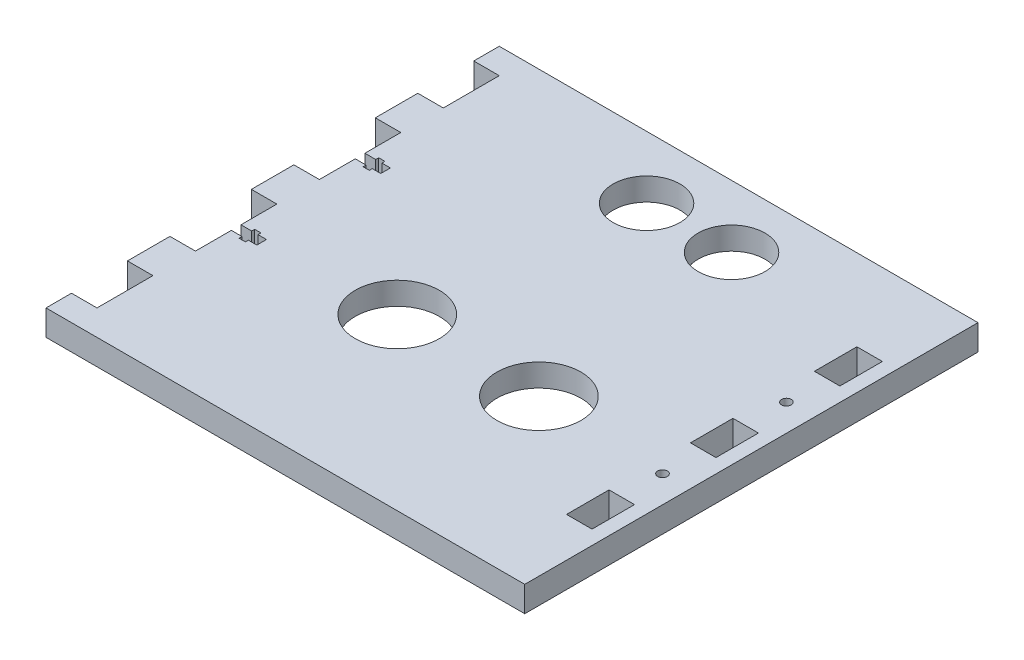
from build123d import *

# Parameters (mm, degrees)
SKETCH1_W           = 160
SKETCH1_H           = 160
BOSS_EXTRUDE1_DEPTH = 9
SKETCH2_W           = 9
SKETCH2_H           = 15
SKETCH2_H_2         = 9
BOSS_EXTRUDE2_DEPTH = 9
SKETCH3_R           = 1.7
SKETCH3_W           = 9
SKETCH3_H           = 15
CUT_EXTRUDE1_DEPTH  = 121.008333044
CUT_EXTRUDE2_DEPTH  = 121.008333044
SKETCH5_R           = 14.825
SKETCH5_R_2         = 11.8
CUT_EXTRUDE3_DEPTH  = 121.008333044
SKETCH6_W           = 40
SKETCH6_H           = 40
SKETCH6_W_2         = 62
SKETCH6_H_2         = 28
CUT_EXTRUDE4_DEPTH  = 1
FILLET1_R           = 8
FILLET2_R           = 4
SKETCH7_W           = 4.618848504
SKETCH7_H           = 0.949501447
SKETCH7_H_2         = 0.946928273
SKETCH7_W_2         = 2.666227781
SKETCH7_H_3         = 0.667544437
CUT_EXTRUDE5_DEPTH  = 1


with BuildPart() as part:
    # Sketch1 → Boss-Extrude1 (new body)
    with BuildSketch(Plane(origin=(0, 0, 0), x_dir=(1, 0, 0), z_dir=(0, 1, 0))):
        Rectangle(SKETCH1_W, SKETCH1_H)
    extrude(amount=BOSS_EXTRUDE1_DEPTH)

    # Sketch2 → Boss-Extrude2 (add)
    with BuildSketch(Plane(origin=(0, 9, 0), x_dir=(1, 0, 0), z_dir=(0, 1, 0))):
        with Locations((-84.5, 0)):
            Rectangle(SKETCH2_W, SKETCH2_H)
        with Locations((-84.5, 43.75)):
            Rectangle(SKETCH2_W, SKETCH2_H)
        with Locations((-84.5, -43.75)):
            Rectangle(SKETCH2_W, SKETCH2_H)
        with Locations((-84.5, 75.5)):
            Rectangle(SKETCH2_W, SKETCH2_H_2)
        with Locations((-84.5, -75.5)):
            Rectangle(SKETCH2_W, SKETCH2_H_2)
    extrude(amount=-BOSS_EXTRUDE2_DEPTH)

    # Sketch3 → Cut-Extrude1 (cut, through all)
    with BuildSketch(Plane(origin=(0, 9, 0), x_dir=(1, 0, 0), z_dir=(0, 1, 0))):
        with Locations(Location((70.5, 21.875, 0), (0, 0, 270))):
            Circle(SKETCH3_R)
        with Locations(Location((70.5, -21.875, 0), (0, 0, 270))):
            Circle(SKETCH3_R)
        with Locations((70.5, 43.75)):
            Rectangle(SKETCH3_W, SKETCH3_H)
        with Locations((70.5, 0)):
            Rectangle(SKETCH3_W, SKETCH3_H)
        with Locations((70.5, -43.75)):
            Rectangle(SKETCH3_W, SKETCH3_H)
    extrude(amount=-CUT_EXTRUDE1_DEPTH, mode=Mode.SUBTRACT)

    # Sketch4 → Cut-Extrude2 (cut, through all)
    with BuildSketch(Plane(origin=(0, 9, 0), x_dir=(1, 0, 0), z_dir=(0, 1, 0))):
        Polygon((-80, 23.575), (-76.2, 23.575), (-76.2, 24.625), (-74, 24.625), (-74, 23.575), (-71, 23.575), (-71, 20.175), (-74, 20.175), (-74, 19.125), (-76.2, 19.125), (-76.2, 20.175), (-80, 20.175), align=None)
        Polygon((-80, -23.575), (-80, -20.175), (-76.2, -20.175), (-76.2, -19.125), (-74, -19.125), (-74, -20.175), (-71, -20.175), (-71, -23.575), (-74, -23.575), (-74, -24.625), (-76.2, -24.625), (-76.2, -23.575), align=None)
    extrude(amount=-CUT_EXTRUDE2_DEPTH, mode=Mode.SUBTRACT)

    # Sketch5 → Cut-Extrude3 (cut, through all)
    with BuildSketch(Plane.XZ):
        with Locations(Location((25, 20, 0), (0, 0, 270))):
            Circle(SKETCH5_R)
        with Locations(Location((-25, 20, 0), (0, 0, 270))):
            Circle(SKETCH5_R)
        with Locations(Location((15, -58, 0), (0, 0, 270))):
            Circle(SKETCH5_R_2)
        with Locations(Location((-15, -58, 0), (0, 0, 270))):
            Circle(SKETCH5_R_2)
    extrude(amount=-CUT_EXTRUDE3_DEPTH, mode=Mode.SUBTRACT)

    # Sketch6 → Cut-Extrude4 (cut)
    with BuildSketch(Plane.XZ):
        with Locations((25, 20)):
            Rectangle(SKETCH6_W, SKETCH6_H)
        with Locations((-25, 20)):
            Rectangle(SKETCH6_W, SKETCH6_H)
        with Locations((0, -58)):
            Rectangle(SKETCH6_W_2, SKETCH6_H_2)
    extrude(amount=-CUT_EXTRUDE4_DEPTH, mode=Mode.SUBTRACT)

    # Fillet1
    fillet1_edges = [part.edges().sort_by_distance(p)[0] for p in [
        (45, 0.5, 40),
        (45, 0.5, 0),
        (5, 0.5, 0),
        (5, 0.5, 40),
        (-45, 0.5, 0),
        (-45, 0.5, 40),
        (-5, 0.5, 40),
        (-5, 0.5, 0),
    ]]
    fillet(fillet1_edges, radius=FILLET1_R)

    # Fillet2
    fillet2_edges = [part.edges().sort_by_distance(p)[0] for p in [
        (-31, 0.5, -72),
        (-31, 0.5, -44),
        (31, 0.5, -44),
        (31, 0.5, -72),
    ]]
    fillet(fillet2_edges, radius=FILLET2_R)

    # Sketch7 → Cut-Extrude5 (cut)
    # profile 1 of 13: a face of its own
    with BuildSketch(Plane.XZ):
        with BuildLine():
            Line((14.716307494, 50), (14.716307494, 42))
            Line((14.716307494, 42), (8.584432293, 42))
            add(Edge.make_bspline(
                [(8.584432293, 42), (8.467732765, 42.002114323), (8.241695744, 42.006209587), (7.913945559, 42.033700455), (7.608901801, 42.083212977), (7.325153779, 42.148524434), (7.063716459, 42.235773262), (6.826009343, 42.344223228), (6.610747625, 42.470384306), (6.417860726, 42.615994855), (6.246643077, 42.781147997), (6.099573517, 42.96775563), (5.974913389, 43.173721238), (5.872306944, 43.398132936), (5.790868345, 43.641977146), (5.74068513, 43.906084588), (5.700929315, 44.187729654), (5.698555005, 44.382599361), (5.697330331, 44.483113541)],
                knots=[0, 0, 0, 0, 1.284318434, 2.48761514, 3.615815328, 4.682763926, 5.688717315, 6.643361222, 7.553177918, 8.429165714, 9.29697799, 10.163814302, 11.036387921, 11.940260126, 12.874573573, 13.857590109, 14.894940747, 16, 16, 16, 16], degree=3))
            add(Edge.make_bspline(
                [(5.697330331, 44.483113541), (5.701522239, 44.634545419), (5.709515044, 44.923283988), (5.789814914, 45.331218702), (5.908603699, 45.697547369), (6.041963081, 45.904003156), (6.106465101, 46.003859762)],
                knots=[0, 0, 0, 0, 1.134442828, 2.163067675, 3.111529734, 4, 4, 4, 4], degree=3))
            add(Edge.make_bspline(
                [(6.106465101, 46.003859762), (6.04210092, 46.102887089), (5.909921036, 46.30625207), (5.788758269, 46.667492108), (5.709715184, 47.071621013), (5.701591736, 47.358615261), (5.697330331, 47.509166935)],
                knots=[0, 0, 0, 0, 0.891054001, 1.829890659, 2.861602291, 4, 4, 4, 4], degree=3))
            add(Edge.make_bspline(
                [(5.697330331, 47.509166935), (5.698617857, 47.609670331), (5.70112493, 47.805370702), (5.740295692, 48.087996068), (5.791522139, 48.353495331), (5.870948199, 48.598148256), (5.976451385, 48.822040036), (6.098661159, 49.029330516), (6.246658355, 49.2163478), (6.418632484, 49.381277572), (6.609950469, 49.529707192), (6.825426497, 49.656375933), (7.0649114, 49.760309704), (7.32447982, 49.852533574), (7.609019235, 49.916460981), (7.913911195, 49.966394955), (8.241705259, 49.993763996), (8.467736005, 49.997876682), (8.584432293, 50)],
                knots=[0, 0, 0, 0, 1.10349067, 2.14871876, 3.130339947, 4.072283605, 4.966317262, 5.845721566, 6.711327442, 7.577907897, 8.458372423, 9.366897675, 10.316310668, 11.323883052, 12.389317162, 13.51591592, 14.717504599, 16, 16, 16, 16], degree=3))
            Line((8.584432293, 50), (14.716307494, 50))
        make_face()
        with Locations((10.206818913, 44.5075587)):
            Rectangle(SKETCH7_W, SKETCH7_H, mode=Mode.SUBTRACT)
        with Locations((10.206818913, 47.491154713)):
            Rectangle(SKETCH7_W, SKETCH7_H_2, mode=Mode.SUBTRACT)
    # profile 2 of 13: a face of its own
    with BuildSketch(Plane.XZ):
        with BuildLine():
            Line((-42.799935671, 47.869411386), (-42.799935671, 50))
            Line((-42.799935671, 50), (-45, 50))
            Line((-45, 50), (-45, 44.71984561))
            add(Edge.make_bspline(
                [(-45, 44.71984561), (-44.998474946, 44.609943001), (-44.99551249, 44.396454421), (-44.959850613, 44.088044921), (-44.910910504, 43.799806688), (-44.835276009, 43.533915217), (-44.741046248, 43.287196194), (-44.621758507, 43.062292589), (-44.482757033, 42.858651961), (-44.324022046, 42.67429604), (-44.140829095, 42.515901716), (-43.936534005, 42.37785874), (-43.712838465, 42.258896161), (-43.466069771, 42.164769866), (-43.199404822, 42.088726024), (-42.910186184, 42.04044096), (-42.6009821, 42.004434146), (-42.387487119, 42.001506918), (-42.277581216, 42)],
                knots=[0, 0, 0, 0, 1.194105263, 2.319579504, 3.371253934, 4.369007829, 5.319638986, 6.237275108, 7.129547171, 7.995311147, 8.874231263, 9.753546977, 10.671183099, 11.621814257, 12.619568151, 13.680420496, 14.805894737, 16, 16, 16, 16], degree=3))
            Line((-42.277581216, 42), (-38.868124799, 42))
            add(Edge.make_bspline(
                [(-38.868124799, 42), (-38.751365425, 42.001505498), (-38.52505104, 42.004423602), (-38.19781295, 42.040215641), (-37.891682452, 42.089179255), (-37.608623009, 42.164454523), (-37.346264807, 42.258235214), (-37.109464652, 42.37816161), (-36.892264675, 42.513878891), (-36.701280988, 42.67596041), (-36.52912651, 42.856491394), (-36.382337386, 43.061460972), (-36.258667974, 43.287537811), (-36.15542609, 43.533025849), (-36.07475816, 43.79933324), (-36.023964781, 44.087983034), (-35.984756015, 44.396280529), (-35.98229116, 44.609916518), (-35.981022837, 44.71984561)],
                knots=[0, 0, 0, 0, 1.231245609, 2.38652009, 3.469574263, 4.499016403, 5.472401524, 6.403211132, 7.294378168, 8.168005031, 9.03862715, 9.920185636, 10.819357258, 11.752144276, 12.725529396, 13.74782712, 14.841116051, 16, 16, 16, 16], degree=3))
            Line((-35.981022837, 44.71984561), (-35.981022837, 50))
            Line((-35.981022837, 50), (-38.181087166, 50))
            Line((-38.181087166, 50), (-38.181087166, 47.869411386))
            Line((-38.181087166, 47.869411386), (-42.799935671, 47.869411386))
        make_face()
        with BuildLine():
            Line((-38.181087166, 45.834030235), (-38.181087166, 44.71984561))
            add(Edge.make_bspline(
                [(-38.181087166, 44.71984561), (-38.182474454, 44.665575955), (-38.185082359, 44.563556618), (-38.219699136, 44.421587978), (-38.272687187, 44.300356471), (-38.350034772, 44.201755582), (-38.44863566, 44.124407998), (-38.569867167, 44.071419947), (-38.711835807, 44.03680317), (-38.813855144, 44.034195264), (-38.868124799, 44.032807977)],
                knots=[0, 0, 0, 0, 1.167680285, 2.195075099, 3.13042725, 4, 4.86957275, 5.804924901, 6.832319715, 8, 8, 8, 8], degree=3))
            Line((-38.868124799, 44.032807977), (-42.277581216, 44.032807977))
            add(Edge.make_bspline(
                [(-42.277581216, 44.032807977), (-42.319058761, 44.034211661), (-42.397574937, 44.036868807), (-42.506465777, 44.072264018), (-42.599410658, 44.126361911), (-42.673429876, 44.20470143), (-42.73117893, 44.303155979), (-42.770684445, 44.423243578), (-42.797189195, 44.564309001), (-42.798978954, 44.665665442), (-42.799935671, 44.71984561)],
                knots=[0, 0, 0, 0, 1.008600795, 1.909261422, 2.763959666, 3.608075402, 4.509465998, 5.52930744, 6.67928928, 8, 8, 8, 8], degree=3))
            Line((-42.799935671, 44.71984561), (-42.799935671, 45.834030235))
            Line((-42.799935671, 45.834030235), (-38.181087166, 45.834030235))
        make_face(mode=Mode.SUBTRACT)
    # profile 3 of 13: a face of its own
    with BuildSketch(Plane.XZ):
        Polygon((5.725148124, -37), (1.281435155, -37), (1.281435155, -36.111257406), (3.058920342, -36.111257406), (3.058920342, -33), (3.947662936, -33), (3.947662936, -36.111257406), (5.725148124, -36.111257406), align=None)
    # profile 4 of 13: a face of its own
    with BuildSketch(Plane.XZ):
        with BuildLine():
            Line((6.168861093, -33), (9.278801843, -33))
            add(Edge.make_bspline(
                [(9.278801843, -33), (9.332823766, -33.000936869), (9.437164813, -33.00274639), (9.58865218, -33.018742706), (9.729380625, -33.045204466), (9.860990688, -33.079629935), (9.980837903, -33.12796047), (10.091936913, -33.183839464), (10.190493635, -33.253783877), (10.281852883, -33.330721179), (10.358790185, -33.422080427), (10.428734598, -33.520637149), (10.484613592, -33.631736158), (10.532944127, -33.751583374), (10.567369596, -33.883193437), (10.593831356, -34.023921882), (10.609827672, -34.175409249), (10.611637193, -34.279750296), (10.612574062, -34.333772219)],
                knots=[0, 0, 0, 0, 1.198012905, 2.31391101, 3.373573855, 4.372517626, 5.325185677, 6.235167836, 7.123597986, 8, 8.876402014, 9.764832164, 10.674814323, 11.627482374, 12.626426145, 13.68608899, 14.801987095, 16, 16, 16, 16], degree=3))
            Line((10.612574062, -34.333772219), (10.612574062, -35.666227781))
            add(Edge.make_bspline(
                [(10.612574062, -35.666227781), (10.611637193, -35.720249704), (10.609827672, -35.824590751), (10.593831356, -35.976078118), (10.567369596, -36.116806563), (10.532944127, -36.248416626), (10.484613592, -36.368263842), (10.428734598, -36.479362851), (10.358790185, -36.577919573), (10.281852883, -36.669278821), (10.190493635, -36.746216123), (10.091936913, -36.816160536), (9.980837903, -36.87203953), (9.860990688, -36.920370065), (9.729380625, -36.954795534), (9.58865218, -36.981257294), (9.437164813, -36.99725361), (9.332823766, -36.999063131), (9.278801843, -37)],
                knots=[0, 0, 0, 0, 1.198012905, 2.31391101, 3.373573855, 4.372517626, 5.325185677, 6.235167836, 7.123597986, 8, 8.876402014, 9.764832164, 10.674814323, 11.627482374, 12.626426145, 13.68608899, 14.801987095, 16, 16, 16, 16], degree=3))
            Line((9.278801843, -37), (6.168861093, -37))
            Line((6.168861093, -37), (6.168861093, -36.111257406))
            Line((6.168861093, -36.111257406), (9.278801843, -36.111257406))
            add(Edge.make_bspline(
                [(9.278801843, -36.111257406), (9.313578416, -36.110230038), (9.379473128, -36.108283379), (9.471866927, -36.087574507), (9.550159448, -36.051315527), (9.615529588, -36.002490382), (9.664138471, -35.937022523), (9.700152043, -35.859293189), (9.720856411, -35.76689897), (9.722803744, -35.701004321), (9.723831468, -35.666227781)],
                knots=[0, 0, 0, 0, 1.156142597, 2.190661088, 3.125070232, 4.010240202, 4.874929768, 5.809338912, 6.843857403, 8, 8, 8, 8], degree=3))
            Line((9.723831468, -35.666227781), (9.723831468, -34.333772219))
            add(Edge.make_bspline(
                [(9.723831468, -34.333772219), (9.722793088, -34.299004882), (9.720825563, -34.233127669), (9.700256126, -34.140616929), (9.663650018, -34.062952235), (9.616424832, -33.99614923), (9.549621827, -33.948924044), (9.471957133, -33.912317936), (9.379446393, -33.891748499), (9.31356918, -33.889780974), (9.278801843, -33.888742594)],
                knots=[0, 0, 0, 0, 1.155738151, 2.189894743, 3.123977008, 4, 4.876022992, 5.810105257, 6.844261849, 8, 8, 8, 8], degree=3))
            Line((9.278801843, -33.888742594), (6.168861093, -33.888742594))
            Line((6.168861093, -33.888742594), (6.168861093, -33))
        make_face()
    # profile 5 of 13: a face of its own
    with BuildSketch(Plane.XZ):
        with BuildLine():
            Line((11.056287031, -33), (14.166227781, -33))
            add(Edge.make_bspline(
                [(14.166227781, -33), (14.220249704, -33.000936869), (14.324590751, -33.00274639), (14.476078118, -33.018742706), (14.616806563, -33.045204466), (14.748416626, -33.079629935), (14.868263842, -33.12796047), (14.979362851, -33.183839464), (15.077919573, -33.253783877), (15.169278821, -33.330721179), (15.246216123, -33.422080427), (15.316160536, -33.520637149), (15.37203953, -33.631736158), (15.420370065, -33.751583374), (15.454795534, -33.883193437), (15.481257294, -34.023921882), (15.49725361, -34.175409249), (15.499063131, -34.279750296), (15.5, -34.333772219)],
                knots=[0, 0, 0, 0, 1.198012905, 2.31391101, 3.373573855, 4.372517626, 5.325185677, 6.235167836, 7.123597986, 8, 8.876402014, 9.764832164, 10.674814323, 11.627482374, 12.626426145, 13.68608899, 14.801987095, 16, 16, 16, 16], degree=3))
            Line((15.5, -34.333772219), (15.5, -37))
            Line((15.5, -37), (11.056287031, -37))
            Line((11.056287031, -37), (11.056287031, -36.111257406))
            Line((11.056287031, -36.111257406), (14.611257406, -36.111257406))
            Line((14.611257406, -36.111257406), (14.611257406, -35.443712969))
            Line((14.611257406, -35.443712969), (11.056287031, -35.443712969))
            Line((11.056287031, -35.443712969), (11.056287031, -34.554970375))
            Line((11.056287031, -34.554970375), (14.611257406, -34.554970375))
            Line((14.611257406, -34.554970375), (14.611257406, -34.333772219))
            add(Edge.make_bspline(
                [(14.611257406, -34.333772219), (14.610219026, -34.299004882), (14.608251501, -34.233127669), (14.587682064, -34.140616929), (14.551075956, -34.062952235), (14.50385077, -33.99614923), (14.437047765, -33.948924044), (14.359383071, -33.912317936), (14.266872331, -33.891748499), (14.200995118, -33.889780974), (14.166227781, -33.888742594)],
                knots=[0, 0, 0, 0, 1.155738151, 2.189894743, 3.123977008, 4, 4.876022992, 5.810105257, 6.844261849, 8, 8, 8, 8], degree=3))
            Line((14.166227781, -33.888742594), (11.056287031, -33.888742594))
            Line((11.056287031, -33.888742594), (11.056287031, -33))
        make_face()
    # profile 6 of 13: a face of its own
    with BuildSketch(Plane.XZ):
        with BuildLine():
            Line((20.387425938, -37), (20.387425938, -34.333772219))
            add(Edge.make_bspline(
                [(20.387425938, -34.333772219), (20.38648907, -34.279750296), (20.384679548, -34.175409249), (20.368683232, -34.023921882), (20.342221472, -33.883193437), (20.307796003, -33.751583374), (20.259465468, -33.631736158), (20.203586475, -33.520637149), (20.133642061, -33.422080427), (20.056704759, -33.330721179), (19.965345511, -33.253783877), (19.866788789, -33.183839464), (19.75568978, -33.12796047), (19.635842564, -33.079629935), (19.504232501, -33.045204466), (19.363504057, -33.018742706), (19.212016689, -33.00274639), (19.107675642, -33.000936869), (19.05365372, -33)],
                knots=[0, 0, 0, 0, 1.198012905, 2.31391101, 3.373573855, 4.372517626, 5.325185677, 6.235167836, 7.123597986, 8, 8.876402014, 9.764832164, 10.674814323, 11.627482374, 12.626426145, 13.68608899, 14.801987095, 16, 16, 16, 16], degree=3))
            Line((19.05365372, -33), (15.943712969, -33))
            Line((15.943712969, -33), (15.943712969, -33.888742594))
            Line((15.943712969, -33.888742594), (19.05365372, -33.888742594))
            add(Edge.make_bspline(
                [(19.05365372, -33.888742594), (19.088421056, -33.889780974), (19.154298269, -33.891748499), (19.246809009, -33.912317936), (19.324473704, -33.948924044), (19.391276708, -33.99614923), (19.438501895, -34.062952235), (19.475108002, -34.140616929), (19.495677439, -34.233127669), (19.497644964, -34.299004882), (19.498683344, -34.333772219)],
                knots=[0, 0, 0, 0, 1.155738151, 2.189894743, 3.123977008, 4, 4.876022992, 5.810105257, 6.844261849, 8, 8, 8, 8], degree=3))
            Line((19.498683344, -34.333772219), (19.498683344, -37))
            Line((19.498683344, -37), (20.387425938, -37))
        make_face()
    # profile 7 of 13: a face of its own
    with BuildSketch(Plane.XZ):
        with BuildLine():
            Line((20.831138907, -33), (23.941079658, -33))
            add(Edge.make_bspline(
                [(23.941079658, -33), (23.99510158, -33.000936869), (24.099442627, -33.00274639), (24.250929995, -33.018742706), (24.391658439, -33.045204466), (24.523268502, -33.079629935), (24.643115718, -33.12796047), (24.754214727, -33.183839464), (24.852771449, -33.253783877), (24.944130697, -33.330721179), (25.021068, -33.422080427), (25.091012413, -33.520637149), (25.146891406, -33.631736158), (25.195221941, -33.751583374), (25.22964741, -33.883193437), (25.25610917, -34.023921882), (25.272105486, -34.175409249), (25.273915008, -34.279750296), (25.274851876, -34.333772219)],
                knots=[0, 0, 0, 0, 1.198012905, 2.31391101, 3.373573855, 4.372517626, 5.325185677, 6.235167836, 7.123597986, 8, 8.876402014, 9.764832164, 10.674814323, 11.627482374, 12.626426145, 13.68608899, 14.801987095, 16, 16, 16, 16], degree=3))
            Line((25.274851876, -34.333772219), (25.274851876, -37))
            Line((25.274851876, -37), (20.831138907, -37))
            Line((20.831138907, -37), (20.831138907, -36.111257406))
            Line((20.831138907, -36.111257406), (24.386109282, -36.111257406))
            Line((24.386109282, -36.111257406), (24.386109282, -35.443712969))
            Line((24.386109282, -35.443712969), (20.831138907, -35.443712969))
            Line((20.831138907, -35.443712969), (20.831138907, -34.554970375))
            Line((20.831138907, -34.554970375), (24.386109282, -34.554970375))
            Line((24.386109282, -34.554970375), (24.386109282, -34.333772219))
            add(Edge.make_bspline(
                [(24.386109282, -34.333772219), (24.385070902, -34.299004882), (24.383103377, -34.233127669), (24.362533941, -34.140616929), (24.325927833, -34.062952235), (24.278702646, -33.99614923), (24.211899642, -33.948924044), (24.134234947, -33.912317936), (24.041724207, -33.891748499), (23.975846994, -33.889780974), (23.941079658, -33.888742594)],
                knots=[0, 0, 0, 0, 1.155738151, 2.189894743, 3.123977008, 4, 4.876022992, 5.810105257, 6.844261849, 8, 8, 8, 8], degree=3))
            Line((23.941079658, -33.888742594), (20.831138907, -33.888742594))
            Line((20.831138907, -33.888742594), (20.831138907, -33))
        make_face()
    # profile 8 of 13: a face of its own
    with BuildSketch(Plane.XZ):
        with BuildLine():
            Line((30.162277814, -33), (27.051020408, -33))
            add(Edge.make_bspline(
                [(27.051020408, -33), (26.997026112, -33.001238827), (26.8928227, -33.003629635), (26.74112494, -33.015529682), (26.600682346, -33.041698725), (26.469196312, -33.07315987), (26.349483192, -33.117650565), (26.238171521, -33.167877376), (26.139997986, -33.23225142), (26.049820676, -33.303157819), (25.972873912, -33.386123722), (25.902057395, -33.475712883), (25.84724118, -33.578338444), (25.798033904, -33.688089264), (25.764140497, -33.808570767), (25.736943587, -33.937755508), (25.721504103, -34.076652652), (25.719560574, -34.17266598), (25.718564845, -34.221856485)],
                knots=[0, 0, 0, 0, 1.250620883, 2.413569083, 3.517942607, 4.555590235, 5.539286071, 6.471228395, 7.376127683, 8.250615108, 9.120365939, 9.990294857, 10.886536268, 11.805927546, 12.770541262, 13.777017219, 14.861099307, 16, 16, 16, 16], degree=3))
            add(Edge.make_bspline(
                [(25.718564845, -34.221856485), (25.71952691, -34.271051928), (25.721396204, -34.366638741), (25.737238644, -34.505464819), (25.763910421, -34.634759504), (25.798140259, -34.755567814), (25.846784646, -34.865206056), (25.902903376, -34.966992892), (25.972346115, -35.057558717), (26.049961871, -35.140387914), (26.13953241, -35.211767069), (26.238955324, -35.273975531), (26.349039394, -35.326543415), (26.469293098, -35.370270324), (26.600502, -35.402584373), (26.741371655, -35.425933199), (26.892712314, -35.440707296), (26.997002177, -35.442687367), (27.051020408, -35.443712969)],
                knots=[0, 0, 0, 0, 1.139098352, 2.213269664, 3.229877014, 4.194658141, 5.114208982, 6.001745697, 6.879921183, 7.749822961, 8.624462156, 9.524080262, 10.46055199, 11.444418549, 12.482246263, 13.585079829, 14.749162069, 16, 16, 16, 16], degree=3))
            Line((27.051020408, -35.443712969), (29.273535221, -35.443712969))
            Line((29.273535221, -35.443712969), (29.273535221, -36.111257406))
            Line((29.273535221, -36.111257406), (25.718564845, -36.111257406))
            Line((25.718564845, -36.111257406), (25.718564845, -37))
            Line((25.718564845, -37), (28.828505596, -37))
            add(Edge.make_bspline(
                [(28.828505596, -37), (28.882527139, -36.998987445), (28.986823395, -36.997032563), (29.138119428, -36.982082637), (29.279252703, -36.95932879), (29.410031892, -36.924873031), (29.530472571, -36.881545922), (29.640920175, -36.829074615), (29.740631714, -36.765087721), (29.829972881, -36.691746037), (29.908990673, -36.608540318), (29.977851022, -36.516568161), (30.034427867, -36.413291322), (30.08239054, -36.301591909), (30.116976749, -36.179207336), (30.143706503, -36.048143977), (30.159424994, -35.907116776), (30.161308753, -35.809782163), (30.162277814, -35.759710336)],
                knots=[0, 0, 0, 0, 1.241172319, 2.396259335, 3.490570964, 4.522894704, 5.499158621, 6.428393942, 7.326456627, 8.214897036, 9.078076813, 9.957541684, 10.847011903, 11.777996992, 12.744996098, 13.763631619, 14.84954544, 16, 16, 16, 16], degree=3))
            add(Edge.make_bspline(
                [(30.162277814, -35.759710336), (30.161345063, -35.710949071), (30.159541497, -35.616664374), (30.143421645, -35.479637938), (30.11723893, -35.352403296), (30.082124664, -35.233201176), (30.03436913, -35.124556124), (29.978279955, -35.023887926), (29.908040791, -34.935703255), (29.830383393, -34.853916336), (29.740526665, -34.783131734), (29.640149976, -34.72237228), (29.530815481, -34.669083984), (29.409916056, -34.627510046), (29.279065531, -34.594750925), (29.138219717, -34.57104055), (28.986732971, -34.558448089), (28.882510017, -34.55615735), (28.828505596, -34.554970375)],
                knots=[0, 0, 0, 0, 1.135602763, 2.195799543, 3.208390456, 4.159279211, 5.084256352, 5.96814632, 6.835261299, 7.702918582, 8.590702617, 9.490242021, 10.4322399, 11.418473619, 12.462425589, 13.571767013, 14.741780832, 16, 16, 16, 16], degree=3))
            Line((28.828505596, -34.554970375), (26.607307439, -34.554970375))
            Line((26.607307439, -34.554970375), (26.607307439, -33.888742594))
            Line((26.607307439, -33.888742594), (30.162277814, -33.888742594))
            Line((30.162277814, -33.888742594), (30.162277814, -33))
        make_face()
    # profile 9 of 13: a face of its own
    with BuildSketch(Plane.XZ):
        with BuildLine():
            Line((-3.281435155, -33), (-6.392692561, -33))
            add(Edge.make_bspline(
                [(-6.392692561, -33), (-6.446686857, -33.001238827), (-6.550890269, -33.003629635), (-6.702588029, -33.015529682), (-6.843030623, -33.041698725), (-6.974516657, -33.07315987), (-7.094229777, -33.117650565), (-7.205541448, -33.167877376), (-7.303714983, -33.23225142), (-7.393892293, -33.303157819), (-7.470839058, -33.386123722), (-7.541655575, -33.475712883), (-7.596471789, -33.578338444), (-7.645679065, -33.688089264), (-7.679572472, -33.808570767), (-7.706769382, -33.937755508), (-7.722208866, -34.076652652), (-7.724152395, -34.17266598), (-7.725148124, -34.221856485)],
                knots=[0, 0, 0, 0, 1.250620883, 2.413569083, 3.517942607, 4.555590235, 5.539286071, 6.471228395, 7.376127683, 8.250615108, 9.120365939, 9.990294857, 10.886536268, 11.805927546, 12.770541262, 13.777017219, 14.861099307, 16, 16, 16, 16], degree=3))
            add(Edge.make_bspline(
                [(-7.725148124, -34.221856485), (-7.724186059, -34.271051928), (-7.722316765, -34.366638741), (-7.706474325, -34.505464819), (-7.679802548, -34.634759504), (-7.64557271, -34.755567814), (-7.596928323, -34.865206056), (-7.540809593, -34.966992892), (-7.471366854, -35.057558717), (-7.393751098, -35.140387914), (-7.304180559, -35.211767069), (-7.204757645, -35.273975531), (-7.094673575, -35.326543415), (-6.974419871, -35.370270324), (-6.843210969, -35.402584373), (-6.702341314, -35.425933199), (-6.551000655, -35.440707296), (-6.446710792, -35.442687367), (-6.392692561, -35.443712969)],
                knots=[0, 0, 0, 0, 1.139098352, 2.213269664, 3.229877014, 4.194658141, 5.114208982, 6.001745697, 6.879921183, 7.749822961, 8.624462156, 9.524080262, 10.46055199, 11.444418549, 12.482246263, 13.585079829, 14.749162069, 16, 16, 16, 16], degree=3))
            Line((-6.392692561, -35.443712969), (-4.170177749, -35.443712969))
            Line((-4.170177749, -35.443712969), (-4.170177749, -36.111257406))
            Line((-4.170177749, -36.111257406), (-7.725148124, -36.111257406))
            Line((-7.725148124, -36.111257406), (-7.725148124, -37))
            Line((-7.725148124, -37), (-4.615207373, -37))
            add(Edge.make_bspline(
                [(-4.615207373, -37), (-4.561185831, -36.998987445), (-4.456889574, -36.997032563), (-4.305593541, -36.982082637), (-4.164460266, -36.95932879), (-4.033681077, -36.924873031), (-3.913240398, -36.881545922), (-3.802792794, -36.829074615), (-3.703081255, -36.765087721), (-3.613740089, -36.691746037), (-3.534722296, -36.608540318), (-3.465861947, -36.516568161), (-3.409285102, -36.413291322), (-3.361322429, -36.301591909), (-3.32673622, -36.179207336), (-3.300006466, -36.048143977), (-3.284287975, -35.907116776), (-3.282404216, -35.809782163), (-3.281435155, -35.759710336)],
                knots=[0, 0, 0, 0, 1.241172319, 2.396259335, 3.490570964, 4.522894704, 5.499158621, 6.428393942, 7.326456627, 8.214897036, 9.078076813, 9.957541684, 10.847011903, 11.777996992, 12.744996098, 13.763631619, 14.84954544, 16, 16, 16, 16], degree=3))
            add(Edge.make_bspline(
                [(-3.281435155, -35.759710336), (-3.282367906, -35.710949071), (-3.284171472, -35.616664374), (-3.300291324, -35.479637938), (-3.326474039, -35.352403296), (-3.361588305, -35.233201176), (-3.409343839, -35.124556124), (-3.465433014, -35.023887926), (-3.535672178, -34.935703255), (-3.613329576, -34.853916336), (-3.703186304, -34.783131734), (-3.803562993, -34.72237228), (-3.912897488, -34.669083984), (-4.033796913, -34.627510046), (-4.164647438, -34.594750925), (-4.305493252, -34.57104055), (-4.456979998, -34.558448089), (-4.561202952, -34.55615735), (-4.615207373, -34.554970375)],
                knots=[0, 0, 0, 0, 1.135602763, 2.195799543, 3.208390456, 4.159279211, 5.084256352, 5.96814632, 6.835261299, 7.702918582, 8.590702617, 9.490242021, 10.4322399, 11.418473619, 12.462425589, 13.571767013, 14.741780832, 16, 16, 16, 16], degree=3))
            Line((-4.615207373, -34.554970375), (-6.83640553, -34.554970375))
            Line((-6.83640553, -34.554970375), (-6.83640553, -33.888742594))
            Line((-6.83640553, -33.888742594), (-3.281435155, -33.888742594))
            Line((-3.281435155, -33.888742594), (-3.281435155, -33))
        make_face()
    # profile 10 of 13: a face of its own
    with BuildSketch(Plane.XZ):
        Polygon((-8.168861093, -37), (-12.612574062, -37), (-12.612574062, -36.111257406), (-10.835088874, -36.111257406), (-10.835088874, -33), (-9.94634628, -33), (-9.94634628, -36.111257406), (-8.168861093, -36.111257406), align=None)
    # profile 11 of 13: a face of its own
    with BuildSketch(Plane.XZ):
        with BuildLine():
            Line((-13.945029625, -34.111257406), (-13.945029625, -33))
            Line((-13.945029625, -33), (-13.056287031, -33))
            Line((-13.056287031, -33), (-13.056287031, -35.666227781))
            add(Edge.make_bspline(
                [(-13.056287031, -35.666227781), (-13.057223899, -35.720249704), (-13.059033421, -35.824590751), (-13.075029737, -35.976078118), (-13.101491497, -36.116806563), (-13.135916966, -36.248416626), (-13.184247501, -36.368263842), (-13.240126495, -36.479362851), (-13.310070908, -36.577919573), (-13.38700821, -36.669278821), (-13.478367458, -36.746216123), (-13.57692418, -36.816160536), (-13.688023189, -36.87203953), (-13.807870405, -36.920370065), (-13.939480468, -36.954795534), (-14.080208913, -36.981257294), (-14.23169628, -36.99725361), (-14.336037327, -36.999063131), (-14.39005925, -37)],
                knots=[0, 0, 0, 0, 1.198012905, 2.31391101, 3.373573855, 4.372517626, 5.325185677, 6.235167836, 7.123597986, 8, 8.876402014, 9.764832164, 10.674814323, 11.627482374, 12.626426145, 13.68608899, 14.801987095, 16, 16, 16, 16], degree=3))
            Line((-14.39005925, -37), (-16.167544437, -37))
            add(Edge.make_bspline(
                [(-16.167544437, -37), (-16.221566399, -36.999063177), (-16.325907523, -36.997253742), (-16.477394356, -36.981256815), (-16.618124665, -36.954797191), (-16.749728314, -36.920364374), (-16.869597786, -36.872059336), (-16.980618704, -36.816090881), (-17.079185437, -36.746658982), (-17.169294495, -36.668797728), (-17.246270083, -36.577981645), (-17.316145626, -36.479345699), (-17.37204377, -36.368268719), (-17.420368847, -36.248415224), (-17.454795888, -36.116806971), (-17.481257191, -35.976078001), (-17.497253638, -35.824590784), (-17.499063141, -35.720249715), (-17.5, -35.666227781)],
                knots=[0, 0, 0, 0, 1.198561958, 2.314971483, 3.375119975, 4.374521565, 5.327626227, 6.238025434, 7.126862754, 7.996333574, 8.873137246, 9.761974566, 10.672373773, 11.625478435, 12.624880025, 13.685028517, 14.801438042, 16, 16, 16, 16], degree=3))
            Line((-17.5, -35.666227781), (-17.5, -33))
            Line((-17.5, -33), (-16.611257406, -33))
            Line((-16.611257406, -33), (-16.611257406, -34.111257406))
            Line((-16.611257406, -34.111257406), (-13.945029625, -34.111257406))
        make_face()
        with BuildLine():
            Line((-16.611257406, -35), (-16.611257406, -35.666227781))
            add(Edge.make_bspline(
                [(-16.611257406, -35.666227781), (-16.610283842, -35.7010323), (-16.608439132, -35.766979966), (-16.587090532, -35.858841144), (-16.553337264, -35.937827568), (-16.502753012, -36.002026491), (-16.437708513, -36.051416487), (-16.359633096, -36.087301198), (-16.267829396, -36.108444623), (-16.202335403, -36.110281592), (-16.167544437, -36.111257406)],
                knots=[0, 0, 0, 0, 1.157782879, 2.193769097, 3.123425812, 3.998313078, 4.884738886, 5.820473727, 6.842217121, 8, 8, 8, 8], degree=3))
            Line((-16.167544437, -36.111257406), (-14.39005925, -36.111257406))
            add(Edge.make_bspline(
                [(-14.39005925, -36.111257406), (-14.355282677, -36.110230038), (-14.289387965, -36.108283379), (-14.196994166, -36.087574507), (-14.118701644, -36.051315527), (-14.053331505, -36.002490382), (-14.004722622, -35.937022523), (-13.96870905, -35.859293189), (-13.948004682, -35.76689897), (-13.946057349, -35.701004321), (-13.945029625, -35.666227781)],
                knots=[0, 0, 0, 0, 1.156142597, 2.190661088, 3.125070232, 4.010240202, 4.874929768, 5.809338912, 6.843857403, 8, 8, 8, 8], degree=3))
            Line((-13.945029625, -35.666227781), (-13.945029625, -35))
            Line((-13.945029625, -35), (-16.611257406, -35))
        make_face(mode=Mode.SUBTRACT)
    # profile 12 of 13: a face of its own
    with BuildSketch(Plane.XZ):
        with BuildLine():
            Line((-18.832455563, -34.554970375), (-18.832455563, -33))
            Line((-18.832455563, -33), (-17.943712969, -33))
            Line((-17.943712969, -33), (-17.943712969, -37))
            Line((-17.943712969, -37), (-21.054970375, -37))
            add(Edge.make_bspline(
                [(-21.054970375, -37), (-21.108966573, -36.998765991), (-21.213173656, -36.996384481), (-21.364845791, -36.984419523), (-21.505377775, -36.958476923), (-21.636414362, -36.926275852), (-21.757223975, -36.884456669), (-21.867004797, -36.831488618), (-21.966450919, -36.769382319), (-22.056086065, -36.698030329), (-22.13318466, -36.615252451), (-22.203506274, -36.525793828), (-22.259131433, -36.424072846), (-22.307890334, -36.314507266), (-22.34187769, -36.194073907), (-22.368915699, -36.065298034), (-22.384563047, -35.926869095), (-22.386453159, -35.831286668), (-22.387425938, -35.782093483)],
                knots=[0, 0, 0, 0, 1.252456057, 2.417110778, 3.52310487, 4.562275153, 5.543991556, 6.481674734, 7.382456616, 8.258227273, 9.129254384, 10.000459844, 10.889144706, 11.809885108, 12.775914308, 13.783867178, 14.859428073, 16, 16, 16, 16], degree=3))
            add(Edge.make_bspline(
                [(-22.387425938, -35.782093483), (-22.387084038, -35.735552339), (-22.386422075, -35.645442755), (-22.376747181, -35.515408467), (-22.362740554, -35.394420956), (-22.342130081, -35.282988287), (-22.314613795, -35.181287828), (-22.281036652, -35.089549006), (-22.244426296, -35.005871152), (-22.212105355, -34.956615744), (-22.196510862, -34.93285056)],
                knots=[0, 0, 0, 0, 1.264693188, 2.448607141, 3.542043126, 4.573810643, 5.525886911, 6.401344675, 7.228666653, 8, 8, 8, 8], degree=3))
            add(Edge.make_bspline(
                [(-22.196510862, -34.93285056), (-22.225983079, -34.877019005), (-22.287076392, -34.761285103), (-22.345801595, -34.564731422), (-22.3814542, -34.345632736), (-22.385375576, -34.191728842), (-22.387425938, -34.111257406)],
                knots=[0, 0, 0, 0, 0.886174957, 1.83696273, 2.869016816, 4, 4, 4, 4], degree=3))
            Line((-22.387425938, -34.111257406), (-22.387425938, -33))
            Line((-22.387425938, -33), (-21.498683344, -33))
            Line((-21.498683344, -33), (-21.498683344, -34.111257406))
            add(Edge.make_bspline(
                [(-21.498683344, -34.111257406), (-21.497750591, -34.146066935), (-21.495994683, -34.211595873), (-21.474355085, -34.302988776), (-21.440384753, -34.381685148), (-21.390618875, -34.446905906), (-21.325398117, -34.496671784), (-21.246701745, -34.530642116), (-21.155308842, -34.552281714), (-21.089779904, -34.554037622), (-21.054970375, -34.554970375)],
                knots=[0, 0, 0, 0, 1.159055291, 2.181921589, 3.112600003, 4, 4.887399997, 5.818078411, 6.840944709, 8, 8, 8, 8], degree=3))
            Line((-21.054970375, -34.554970375), (-18.832455563, -34.554970375))
        make_face()
        with Locations((-20.165569453, -35.777485188)):
            Rectangle(SKETCH7_W_2, SKETCH7_H_3, mode=Mode.SUBTRACT)
    # profile 13 of 13: a face of its own
    with BuildSketch(Plane.XZ):
        Polygon((-22.831138907, -37), (-27.274851876, -37), (-27.274851876, -36.111257406), (-25.497366689, -36.111257406), (-25.497366689, -33), (-24.608624095, -33), (-24.608624095, -36.111257406), (-22.831138907, -36.111257406), align=None)
    extrude(amount=-CUT_EXTRUDE5_DEPTH, mode=Mode.SUBTRACT)


solid = part.part
